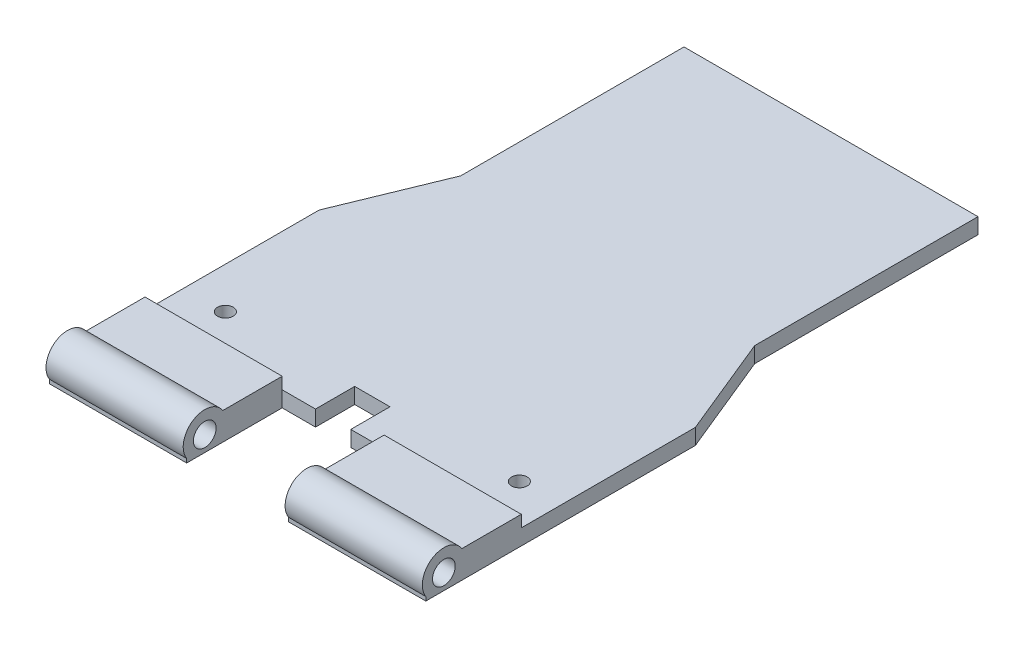
from build123d import *

# Parameters (mm, degrees)
BOSS_EXTRUDE1_DEPTH = 3
SKETCH5_W           = 35
SKETCH5_H           = 23
BOSS_EXTRUDE2_DEPTH = 3
BOSS_EXTRUDE5_DEPTH = 35
BOSS_EXTRUDE8_START = -35
BOSS_EXTRUDE8_DEPTH = 35
CUT_EXTRUDE1_START  = -96
SKETCH11_R          = 2.9
CUT_EXTRUDE1_DEPTH  = 96
BOSS_EXTRUDE7_DEPTH = 1
SKETCH17_R          = 2
CUT_EXTRUDE2_DEPTH  = 10


with BuildPart() as part:
    # Sketch1 → Boss-Extrude1 (new body)
    with BuildSketch(Plane(origin=(0, 0, 0), x_dir=(1, 0, 0), z_dir=(0, 1, 0))):
        Polygon((0, 0), (0, 23), (8.5, 23), (8.5, 33), (17.5, 33), (17.5, 23), (26, 23), (26, 0), (61, 0), (61, 28.801365462), (61, 67.406151765), (50.5, 93.029580251), (50.5, 150), (-24.5, 150), (-24.5, 93.029580251), (-35, 67.406151765), (-35, 28.801365462), (-35, 0), align=None)
    extrude(amount=BOSS_EXTRUDE1_DEPTH)

    # Sketch5 → Boss-Extrude2 (add)
    with BuildSketch(Plane(origin=(0, 3, 0), x_dir=(1, 0, 0), z_dir=(0, 1, 0))):
        with Locations((-17.5, 11.5)):
            Rectangle(SKETCH5_W, SKETCH5_H)
        with Locations((43.5, 11.5)):
            Rectangle(SKETCH5_W, SKETCH5_H)
    extrude(amount=BOSS_EXTRUDE2_DEPTH)

    # Sketch12 → Boss-Extrude5 (add)
    with BuildSketch(Plane.ZY.offset(35)):
        with BuildLine():
            Line((-7.857598958, 0), (1.361945499, 0))
            ThreePointArc((1.361945499, 0), (-3.247826729, 8.5), (-7.857598958, 0))
        make_face()
    extrude(amount=-BOSS_EXTRUDE5_DEPTH)

    # Sketch15 → Boss-Extrude8 (add)
    with BuildSketch(Plane(origin=(61, 0, 0), x_dir=(0, 0, -1), z_dir=(1, 0, 0)).offset(BOSS_EXTRUDE8_START)):
        with BuildLine():
            Line((7.857598958, 0), (-1.361945499, 0))
            ThreePointArc((-1.361945499, 0), (3.247826729, 8.5), (7.857598958, 0))
        make_face()
    extrude(amount=BOSS_EXTRUDE8_DEPTH)

    # Sketch11 → Cut-Extrude1 (cut)
    with BuildSketch(Plane.ZY.offset(35).offset(CUT_EXTRUDE1_START)):
        with Locations((-3.247826729, 3)):
            Circle(SKETCH11_R)
    extrude(amount=CUT_EXTRUDE1_DEPTH, mode=Mode.SUBTRACT)

    # Sketch14 → Boss-Extrude7 (add)
    with BuildSketch(Plane.XZ):
        Polygon((50.5, -93.029580251), (61, -67.406151765), (61, 1.361945499), (26, 1.361945499), (26, -23), (17.5, -23), (17.5, -33), (8.5, -33), (8.5, -23), (0, -23), (0, 1.361945499), (-35, 1.361945499), (-35, -67.406151765), (-24.5, -93.029580251), (-24.5, -150), (50.5, -150), align=None)
    extrude(amount=BOSS_EXTRUDE7_DEPTH)

    # Sketch17 → Cut-Extrude2 (cut)
    with BuildSketch(Plane(origin=(0, 3, 0), x_dir=(1, 0, 0), z_dir=(0, 1, 0))):
        with Locations(Location((-24.5, 33, 0), (0, 0, 270))):
            Circle(SKETCH17_R)
        with Locations(Location((50.5, 33, 0), (0, 0, 270))):
            Circle(SKETCH17_R)
    extrude(amount=-CUT_EXTRUDE2_DEPTH, mode=Mode.SUBTRACT)


solid = part.part
